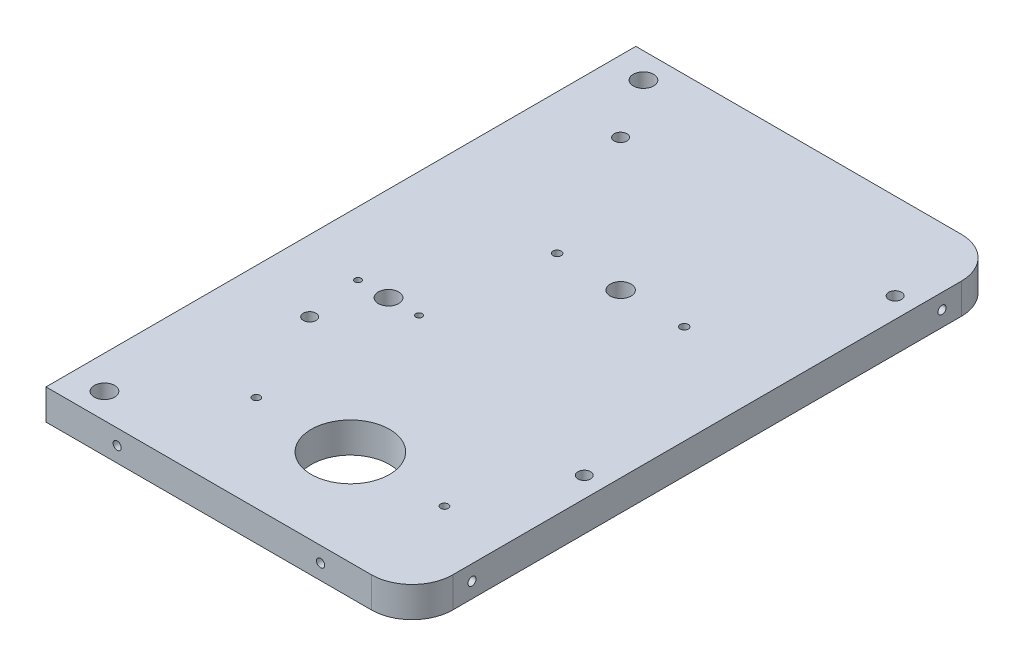
from build123d import *
from build123d.topology import SkipClean

# Parameters (mm, degrees)
SKETCH_1_W           = 20
SKETCH_1_H           = 44
EXTRUDE_1_DEPTH      = 3
SKETCH_2_R           = 0.8
CUT_EXTRUDE_1_DEPTH  = 3
SKETCH_3_W           = 21
SKETCH_3_H           = 44
EXTRUDE_3_DEPTH      = 3
SKETCH_4_W           = 62
SKETCH_4_H           = 25
EXTRUDE_4_DEPTH      = 3
SKETCH_5_R           = 2
SKETCH_5_W           = 62.003092034
SKETCH_5_H           = 2.997788852
CUT_EXTRUDE_2_DEPTH  = 3
SKETCH_6_W           = 62
SKETCH_6_H           = 20
EXTRUDE_5_DEPTH      = 3
SKETCH_7_R           = 0.8
SKETCH_7_R_2         = 0.25
CUT_EXTRUDE_4_DEPTH  = 3
SKETCH_8_R           = 0.8
EXTRUDE_6_DEPTH      = 3
CUT_EXTRUDE_5_DEPTH  = 3
SKETCH_15_R          = 1.5
CUT_EXTRUDE_6_DEPTH  = 3
SKETCH_24_W          = 62
SKETCH_24_H          = 13
EXTRUDE_7_DEPTH      = 3
SKETCH_25_W          = 62
SKETCH_25_H          = 15
SKETCH_25_R          = 1.5
EXTRUDE_8_DEPTH      = 3
SKETCH_26_R          = 1.5
CUT_EXTRUDE_7_DEPTH  = 3
SKETCH_31_R          = 1.5
EXTRUDE_10_DEPTH     = 3
SKETCH_36_R          = 7.7
CUT_EXTRUDE_12_DEPTH = 3
SKETCH_45_R          = 1.05
CUT_EXTRUDE_13_DEPTH = 3
SKETCH_50_R          = 1.999999997
CUT_EXTRUDE_14_DEPTH = 3
EXTRUDE_START        = -3
SKETCH_51_R          = 1.999999997
EXTRUDE_11_DEPTH     = 3
SKETCH_52_W          = 62
SKETCH_52_H          = 5
EXTRUDE_12_DEPTH     = 3
SKETCH_53_W          = 10
SKETCH_53_H          = 116
EXTRUDE_13_DEPTH     = 3
SKETCH_54_R          = 2
CUT_EXTRUDE_15_DEPTH = 10
CUT_EXTRUDE_17_DEPTH = 7
SKETCH_57_R          = 7.7
SKETCH_57_R_2        = 1.5
SKETCH_57_R_3        = 2
SKETCH_57_R_4        = 1.500025758
SKETCH_57_R_5        = 1.05
SKETCH_57_R_6        = 0.8
SKETCH_57_R_7        = 0.25
SKETCH_57_R_8        = 0.225
EXTRUDE_14_DEPTH     = 3
SKETCH_58_R          = 1
CUT_EXTRUDE_18_DEPTH = 6
SKETCH_59_R          = 1
CUT_EXTRUDE_19_DEPTH = 6
CUT_EXTRUDE_START    = -6
SKETCH_60_R          = 1
CUT_EXTRUDE_20_DEPTH = 6
SKETCH_61_R          = 3
CUT_EXTRUDE_21_DEPTH = 3
SKETCH_62_R          = 2
CUT_EXTRUDE_22_DEPTH = 3
SKETCH_63_R          = 2.55
CUT_EXTRUDE_23_DEPTH = 3
SKETCH_64_R          = 2.05
CUT_EXTRUDE_24_DEPTH = 3
SKETCH_65_R          = 2
EXTRUDE_15_DEPTH     = 6
SKETCH_66_R          = 1
CUT_EXTRUDE_25_DEPTH = 6
SKETCH_67_R          = 2.932086284
SKETCH_67_R_2        = 2.55
EXTRUDE_16_DEPTH     = 3
EXTRUDE_START_2      = -6
SKETCH_68_R          = 1.5
SKETCH_68_R_2        = 1.25
SKETCH_68_R_3        = 1
SKETCH_68_R_4        = 0.75
SKETCH_68_R_5        = 1.05
SKETCH_68_R_6        = 1.6
EXTRUDE_17_DEPTH     = 6
SKETCH_69_R          = 0.8
SKETCH_69_R_2        = 0.625
SKETCH_69_R_3        = 1
EXTRUDE_18_DEPTH     = 6
SKETCH_70_R          = 1
SKETCH_70_R_2        = 0.8
EXTRUDE_19_DEPTH     = 6
SKETCH_71_R          = 1
SKETCH_71_R_2        = 0.8
EXTRUDE_20_DEPTH     = 6
SKETCH_72_R          = 1
SKETCH_72_R_2        = 0.8
EXTRUDE_21_DEPTH     = 6
SKETCH_73_R          = 0.947367803
SKETCH_73_R_2        = 0.960169645
EXTRUDE_22_DEPTH     = 6
SKETCH_74_R          = 0.8
CUT_EXTRUDE_26_DEPTH = 6


with BuildPart() as part:
    # Эскиз1 → Бобышка-Вытянуть1 (new body)
    with BuildSketch(Plane(origin=(0, 0, 0), x_dir=(1, 0, 0), z_dir=(0, 1, 0))):
        Rectangle(SKETCH_1_W, SKETCH_1_H)
    extrude(amount=EXTRUDE_1_DEPTH)

    # Эскиз2 → Вырез-Вытянуть1 (cut)
    with BuildSketch(Plane(origin=(0, 3, 0), x_dir=(1, 0, 0), z_dir=(0, 1, 0))):
        with Locations(Location((6, -15, 0), (0, 0, 270))):
            Circle(SKETCH_2_R)
        with Locations(Location((-6, -15, 0), (0, 0, 270))):
            Circle(SKETCH_2_R)
    extrude(amount=-CUT_EXTRUDE_1_DEPTH, mode=Mode.SUBTRACT)

    # Эскиз3 → Бобышка-Вытянуть3 (add)
    with BuildSketch(Plane.XZ):
        with Locations((20.5, 0)):
            Rectangle(SKETCH_3_W, SKETCH_3_H)
        with Locations((-20.5, 0)):
            Rectangle(SKETCH_3_W, SKETCH_3_H)
    extrude(amount=-EXTRUDE_3_DEPTH)

    # Эскиз4 → Бобышка-Вытянуть4 (add)
    with BuildSketch(Plane(origin=(0, 0, 0), x_dir=(-1, 0, 0), z_dir=(0, -1, 0))):
        with Locations((0, 34.5)):
            Rectangle(SKETCH_4_W, SKETCH_4_H)
    extrude(amount=-EXTRUDE_4_DEPTH)

    # Эскиз5 → Вырез-Вытянуть2 (cut)
    with BuildSketch(Plane.XZ):
        with Locations(Location((22.498453983, -18, 0), (0, 0, 270))):
            Circle(SKETCH_5_R)
        with Locations(Location((-22.501546017, -18, 0), (0, 0, 90))):
            Circle(SKETCH_5_R)
        with Locations((-0.001546017, -45.501105574)):
            Rectangle(SKETCH_5_W, SKETCH_5_H)
    extrude(amount=-CUT_EXTRUDE_2_DEPTH, mode=Mode.SUBTRACT)

    # Эскиз6 → Бобышка-Вытянуть5 (add)
    with BuildSketch(Plane.XZ):
        with Locations((0, -54.002211148)):
            Rectangle(SKETCH_6_W, SKETCH_6_H)
        with Locations((0, 32)):
            Rectangle(SKETCH_6_W, SKETCH_6_H)
    extrude(amount=-EXTRUDE_5_DEPTH)

    # Эскиз7 → Вырез-Вытянуть4 (cut)
    with BuildSketch(Plane(origin=(0, 3, 0), x_dir=(1, 0, 0), z_dir=(0, 1, 0))):
        with Locations(Location((-16.501546017, -6.139753031, 0), (0, 0, 270))):
            Circle(SKETCH_7_R)
        with Locations(Location((-28.501546017, -6.139753031, 0), (0, 0, 270))):
            Circle(SKETCH_7_R)
        with Locations(Location((-21.23197804, -6.139414793, 0), (0, 0, 270))):
            Circle(SKETCH_7_R_2)
        with Locations(Location((-23.13293586, -5.037238659, 0), (0, 0, 270))):
            Circle(SKETCH_7_R_2)
        with Locations(Location((-23.13293586, -7.241590927, 0), (0, 0, 270))):
            Circle(SKETCH_7_R_2)
    extrude(amount=-CUT_EXTRUDE_4_DEPTH, mode=Mode.SUBTRACT)

    # Эскиз8 → Бобышка-Вытянуть6 (add)
    with BuildSketch(Plane(origin=(0, 3, 0), x_dir=(1, 0, 0), z_dir=(0, 1, 0))):
        with Locations((6, -15)):
            Circle(SKETCH_8_R)
        with Locations((-6, -15)):
            Circle(SKETCH_8_R)
    extrude(amount=-EXTRUDE_6_DEPTH)

    # Эскиз14 → Вырез-Вытянуть5 (cut)
    with BuildSketch(Plane(origin=(0, 3, 0), x_dir=(1, 0, 0), z_dir=(0, 1, 0))):
        Polygon((-0.001546017, -35), (-31, -35), (-31, -42), (-0.001546017, -42), (31, -42), (31, -35), align=None)
    extrude(amount=-CUT_EXTRUDE_5_DEPTH, mode=Mode.SUBTRACT)

    # Эскиз15 → Вырез-Вытянуть6 (cut)
    with BuildSketch(Plane(origin=(0, 3, 0), x_dir=(1, 0, 0), z_dir=(0, 1, 0))):
        with Locations(Location((-27, -31, 0), (0, 0, 270))):
            Circle(SKETCH_15_R)
        with Locations(Location((27, -31, 0), (0, 0, 90))):
            Circle(SKETCH_15_R)
        with Locations(Location((27, 44, 0), (0, 0, 270))):
            Circle(SKETCH_15_R)
        with Locations(Location((-27, 44, 0), (0, 0, 90))):
            Circle(SKETCH_15_R)
        Polygon((-0.001546017, 48), (31, 48), (31, 64.002211148), (-0.001546017, 64.002211148), (-31, 64.002211148), (-31, 48), align=None)
    extrude(amount=-CUT_EXTRUDE_6_DEPTH, mode=Mode.SUBTRACT)

    # Эскиз24 → Бобышка-Вытянуть7 (add)
    with BuildSketch(Plane.XZ):
        with Locations((0, -54.5)):
            Rectangle(SKETCH_24_W, SKETCH_24_H)
    extrude(amount=-EXTRUDE_7_DEPTH)

    # Эскиз25 → Бобышка-Вытянуть8 (add)
    with BuildSketch(Plane(origin=(0, 3, 0), x_dir=(1, 0, 0), z_dir=(0, 1, 0))):
        with Locations((0, -42.5)):
            Rectangle(SKETCH_25_W, SKETCH_25_H)
        with Locations(Location((27, -46, 0), (0, 0, 270))):
            Circle(SKETCH_25_R, mode=Mode.SUBTRACT)
        with Locations(Location((-27, -46, 0), (0, 0, 90))):
            Circle(SKETCH_25_R, mode=Mode.SUBTRACT)
    extrude(amount=-EXTRUDE_8_DEPTH)

    # Эскиз26 → Вырез-Вытянуть7 (cut)
    with BuildSketch(Plane(origin=(0, 3, 0), x_dir=(1, 0, 0), z_dir=(0, 1, 0))):
        with Locations(Location((-27, -17.139753031, 0), (0, 0, 270))):
            Circle(SKETCH_26_R)
        with Locations(Location((27, -17.139753031, 0), (0, 0, 270))):
            Circle(SKETCH_26_R)
    extrude(amount=-CUT_EXTRUDE_7_DEPTH, mode=Mode.SUBTRACT)

    # Эскиз31 → Бобышка-Вытянуть10 (add)
    with BuildSketch(Plane(origin=(0, 3, 0), x_dir=(1, 0, 0), z_dir=(0, 1, 0))):
        with Locations((-27, -31)):
            Circle(SKETCH_31_R)
        with Locations((27, -31)):
            Circle(SKETCH_31_R)
        with Locations((27, -46)):
            Circle(SKETCH_31_R)
        with Locations((-27, -46)):
            Circle(SKETCH_31_R)
    extrude(amount=-EXTRUDE_10_DEPTH)

    # Эскиз36 → Вырез-Вытянуть12 (cut)
    with BuildSketch(Plane.XZ):
        with Locations(Location((0, 36.139753031, 0), (0, 0, 270))):
            Circle(SKETCH_36_R)
    extrude(amount=-CUT_EXTRUDE_12_DEPTH, mode=Mode.SUBTRACT)

    # Эскиз45 → Вырез-Вытянуть13 (cut)
    with BuildSketch(Plane(origin=(0, 3, 0), x_dir=(1, 0, 0), z_dir=(0, 1, 0))):
        with Locations(Location((18.5, -36.139777203, 0), (0, 0, 270))):
            Circle(SKETCH_45_R)
        with Locations(Location((-18.5, -36.139777203, 0), (0, 0, 90))):
            Circle(SKETCH_45_R)
    extrude(amount=-CUT_EXTRUDE_13_DEPTH, mode=Mode.SUBTRACT)

    # Эскиз50 → Вырез-Вытянуть14 (cut)
    with BuildSketch(Plane(origin=(0, 3, 0), x_dir=(1, 0, 0), z_dir=(0, 1, 0))):
        with Locations(Location((26, 54.5, 0), (0, 0, 270))):
            Circle(SKETCH_50_R)
        with Locations(Location((-26.000000007, 54.5, 0), (0, 0, 90))):
            Circle(SKETCH_50_R)
    extrude(amount=-CUT_EXTRUDE_14_DEPTH, mode=Mode.SUBTRACT)

    # Эскиз51 → Бобышка-Вытянуть11 (add)
    with BuildSketch(Plane(origin=(0, 0, 0), x_dir=(-1, 0, 0), z_dir=(0, -1, 0)).offset(EXTRUDE_START)):
        with Locations((26.000000007, 54.5)):
            Circle(SKETCH_51_R)
        with Locations((-26, 54.5)):
            Circle(SKETCH_51_R)
    extrude(amount=EXTRUDE_11_DEPTH)

    # Эскиз52 → Бобышка-Вытянуть12 (add)
    with BuildSketch(Plane.XZ):
        with Locations((0, 52.5)):
            Rectangle(SKETCH_52_W, SKETCH_52_H)
    extrude(amount=-EXTRUDE_12_DEPTH)

    # Эскиз53 → Бобышка-Вытянуть13 (add)
    with BuildSketch(Plane.XZ):
        with Locations((-36, -3)):
            Rectangle(SKETCH_53_W, SKETCH_53_H)
    extrude(amount=-EXTRUDE_13_DEPTH)

    # Эскиз54 → Вырез-Вытянуть15 (cut)
    with BuildSketch(Plane.XZ):
        with Locations(Location((-34.5, 50, 0), (0, 0, 270))):
            Circle(SKETCH_54_R)
        with Locations(Location((-34.5, -56, 0), (0, 0, 90))):
            Circle(SKETCH_54_R)
    extrude(amount=-CUT_EXTRUDE_15_DEPTH, mode=Mode.SUBTRACT)

    # Эскиз55 → Вырез-Вытянуть17 (cut)
    with BuildSketch(Plane(origin=(0, 0, 0), x_dir=(-1, 0, 0), z_dir=(0, -1, 0))):
        with BuildLine():
            Line((-31, 61), (-23, 61))
            ThreePointArc((-23, 61), (-28.656854249, 58.656854249), (-31, 53))
            Line((-31, 53), (-31, 61))
        make_face()
        with BuildLine():
            Line((-31, -55), (-23, -55))
            ThreePointArc((-23, -55), (-28.656854249, -52.656854249), (-31, -47))
            Line((-31, -47), (-31, -55))
        make_face()
    extrude(amount=-CUT_EXTRUDE_17_DEPTH, mode=Mode.SUBTRACT)

    # Эскиз57 → Бобышка-Вытянуть14 (add)
    with BuildSketch(Plane.XZ):
        with BuildLine():
            Line((-41, 55), (23, 55))
            ThreePointArc((23, 55), (28.656854249, 52.656854249), (31, 47))
            Line((31, 47), (31, -53))
            ThreePointArc((31, -53), (28.656854249, -58.656854249), (23, -61))
            Line((23, -61), (-41, -61))
            Line((-41, -61), (-41, 55))
        make_face()
        with Locations(Location((0, 36.139753031, 0), (0, 0, 270))):
            Circle(SKETCH_57_R, mode=Mode.SUBTRACT)
        with Locations(Location((27, 17.139753031, 0), (0, 0, 90))):
            Circle(SKETCH_57_R_2, mode=Mode.SUBTRACT)
        with Locations(Location((-27, 17.139753031, 0), (0, 0, 90))):
            Circle(SKETCH_57_R_2, mode=Mode.SUBTRACT)
        with Locations(Location((-22.501546017, -18, 0), (0, 0, 270))):
            Circle(SKETCH_57_R_3, mode=Mode.SUBTRACT)
        with Locations(Location((22.498453983, -18, 0), (0, 0, 270))):
            Circle(SKETCH_57_R_3, mode=Mode.SUBTRACT)
        with Locations(Location((-27, -44, 0), (0, 0, 270))):
            Circle(SKETCH_57_R_4, mode=Mode.SUBTRACT)
        with Locations(Location((27, -44, 0), (0, 0, 90))):
            Circle(SKETCH_57_R_2, mode=Mode.SUBTRACT)
        with Locations(Location((-34.5, -56, 0), (0, 0, 270))):
            Circle(SKETCH_57_R_3, mode=Mode.SUBTRACT)
        with Locations(Location((-34.5, 50, 0), (0, 0, 270))):
            Circle(SKETCH_57_R_3, mode=Mode.SUBTRACT)
        with Locations(Location((-18.5, 36.139777203, 0), (0, 0, 270))):
            Circle(SKETCH_57_R_5, mode=Mode.SUBTRACT)
        with Locations(Location((18.5, 36.139777203, 0), (0, 0, 90))):
            Circle(SKETCH_57_R_5, mode=Mode.SUBTRACT)
        with Locations(Location((-16.501546017, 6.139753031, 0), (0, 0, 90))):
            Circle(SKETCH_57_R_6, mode=Mode.SUBTRACT)
        with Locations(Location((-28.501546017, 6.139753031, 0), (0, 0, 90))):
            Circle(SKETCH_57_R_6, mode=Mode.SUBTRACT)
        with Locations(Location((-23.132935794, 7.241590631, 0), (0, 0, 90.000015136))):
            Circle(SKETCH_57_R_7, mode=Mode.SUBTRACT)
        with Locations(Location((-21.231977973, 6.1394145, 0), (0, 0, 90.000015523))):
            Circle(SKETCH_57_R_7, mode=Mode.SUBTRACT)
        with Locations(Location((-23.13293579, 5.037238363, 0), (0, 0, 90.000015909))):
            Circle(SKETCH_57_R_7, mode=Mode.SUBTRACT)
        with Locations(Location((-3.521223918, -18.000032755, 0), (0, 0, 270))):
            Circle(SKETCH_57_R_8, mode=Mode.SUBTRACT)
        with Locations(Location((1.558776082, -18.000032755, 0), (0, 0, 270))):
            Circle(SKETCH_57_R_8, mode=Mode.SUBTRACT)
    extrude(amount=EXTRUDE_14_DEPTH)

    # Эскиз58 → Вырез-Вытянуть18 (cut)
    with BuildSketch(Plane(origin=(31, 0, 0), x_dir=(0, 0, -1), z_dir=(1, 0, 0))):
        with Locations((49.220009086, 0)):
            Circle(SKETCH_58_R)
        with Locations((-43.220009523, 0)):
            Circle(SKETCH_58_R)
    extrude(amount=-CUT_EXTRUDE_18_DEPTH, mode=Mode.SUBTRACT)

    # Эскиз59 → Вырез-Вытянуть19 (cut)
    with BuildSketch(Plane.XY.offset(55)):
        with Locations((13, 0)):
            Circle(SKETCH_59_R)
        with Locations((-27, 0)):
            Circle(SKETCH_59_R)
    extrude(amount=-CUT_EXTRUDE_19_DEPTH, mode=Mode.SUBTRACT)

    # Эскиз60 → Вырез-Вытянуть20 (cut)
    with BuildSketch(Plane(origin=(0, 0, -61), x_dir=(-1, 0, 0), z_dir=(0, 0, -1)).offset(CUT_EXTRUDE_START)):
        with Locations(Location((27, 0, 0), (0, 0, 180))):
            Circle(SKETCH_60_R)
        with Locations(Location((-13, 0, 0), (0, 0, 180))):
            Circle(SKETCH_60_R)
    extrude(amount=CUT_EXTRUDE_20_DEPTH, mode=Mode.SUBTRACT)

    # Эскиз61 → Вырез-Вытянуть21 (cut)
    with BuildSketch(Plane.XZ.offset(3)):
        with Locations(Location((-22.501977973, 6.139414498, 0), (0, 0, 270))):
            Circle(SKETCH_61_R)
    extrude(amount=-CUT_EXTRUDE_21_DEPTH, mode=Mode.SUBTRACT)

    # Эскиз62 → Вырез-Вытянуть22 (cut)
    with BuildSketch(Plane.XZ):
        with Locations(Location((-22.501977973, 6.139414498, 0), (0, 0, 270))):
            Circle(SKETCH_62_R)
    extrude(amount=-CUT_EXTRUDE_22_DEPTH, mode=Mode.SUBTRACT)

    # Эскиз63 → Вырез-Вытянуть23 (cut)
    with BuildSketch(Plane.XZ.offset(3)):
        with Locations((-0.981223814, -18.000033018)):
            Circle(SKETCH_63_R)
    extrude(amount=-CUT_EXTRUDE_23_DEPTH, mode=Mode.SUBTRACT)

    # Эскиз64 → Вырез-Вытянуть24 (cut)
    with BuildSketch(Plane.XZ):
        with Locations(Location((-0.981223814, -18.000033018, 0), (0, 0, 270))):
            Circle(SKETCH_64_R)
    extrude(amount=-CUT_EXTRUDE_24_DEPTH, mode=Mode.SUBTRACT)

    # Эскиз65 → Бобышка-Вытянуть15 (add)
    with BuildSketch(Plane(origin=(0, -3, 0), x_dir=(-1, 0, 0), z_dir=(0, -1, 0))):
        with Locations((22.501546017, 18)):
            Circle(SKETCH_65_R)
        with Locations((-22.498453983, 18)):
            Circle(SKETCH_65_R)
    extrude(amount=-EXTRUDE_15_DEPTH)

    # Эскиз66 → Вырез-Вытянуть25 (cut)
    with BuildSketch(Plane.XZ.offset(3)):
        with Locations(Location((10.604776186, -18.000033018, 0), (0, 0, 270))):
            Circle(SKETCH_66_R)
        with Locations(Location((-12.567223814, -18.000033018, 0), (0, 0, 90))):
            Circle(SKETCH_66_R)
    extrude(amount=-CUT_EXTRUDE_25_DEPTH, mode=Mode.SUBTRACT)

    # Эскиз67 → Бобышка-Вытянуть16 (add)
    with BuildSketch(Plane.XZ.offset(3)):
        with Locations((-0.981223814, -18.000033018)):
            Circle(SKETCH_67_R)
        with Locations(Location((-0.981223814, -18.000033018, 0), (0, 0, 270))):
            Circle(SKETCH_67_R_2, mode=Mode.SUBTRACT)
    extrude(amount=-EXTRUDE_16_DEPTH)

    # Эскиз68 → Бобышка-Вытянуть17 (add)
    # profile 1 of 8: a face of its own
    with SkipClean():  # the faces are left unmerged after this step: merging them gives an invalid solid
        with BuildSketch(Plane.XZ.offset(3).offset(EXTRUDE_START_2)):
            with Locations((27, 17.139753031)):
                Circle(SKETCH_68_R)
            with Locations(Location((27, 17.139753031, 0), (0, 0, 270))):
                Circle(SKETCH_68_R_2, mode=Mode.SUBTRACT)
        # profile 2 of 8: a face of its own
        with BuildSketch(Plane.XZ.offset(3).offset(EXTRUDE_START_2)):
            with Locations((27, -44)):
                Circle(SKETCH_68_R)
            with Locations(Location((27, -44, 0), (0, 0, 270))):
                Circle(SKETCH_68_R_2, mode=Mode.SUBTRACT)
        # profile 3 of 8: a face of its own
        with BuildSketch(Plane.XZ.offset(3).offset(EXTRUDE_START_2)):
            with Locations((-27, 17.139753031)):
                Circle(SKETCH_68_R)
            with Locations(Location((-27, 17.139753031, 0), (0, 0, 270))):
                Circle(SKETCH_68_R_2, mode=Mode.SUBTRACT)
        # profile 4 of 8: a face of its own
        with BuildSketch(Plane.XZ.offset(3).offset(EXTRUDE_START_2)):
            with Locations((10.604776186, -18.000033018)):
                Circle(SKETCH_68_R_3)
            with Locations(Location((10.604776186, -18.000033018, 0), (0, 0, 270))):
                Circle(SKETCH_68_R_4, mode=Mode.SUBTRACT)
        # profile 5 of 8: a face of its own
        with BuildSketch(Plane.XZ.offset(3).offset(EXTRUDE_START_2)):
            with Locations((-12.567223814, -18.000033018)):
                Circle(SKETCH_68_R_3)
            with Locations(Location((-12.567223814, -18.000033018, 0), (0, 0, 90))):
                Circle(SKETCH_68_R_4, mode=Mode.SUBTRACT)
        # profile 6 of 8: a face of its own
        with BuildSketch(Plane.XZ.offset(3).offset(EXTRUDE_START_2)):
            with Locations((18.5, 36.139777203)):
                Circle(SKETCH_68_R_5)
            with Locations(Location((18.5, 36.139777203, 0), (0, 0, 270))):
                Circle(SKETCH_68_R_4, mode=Mode.SUBTRACT)
        # profile 7 of 8: a face of its own
        with BuildSketch(Plane.XZ.offset(3).offset(EXTRUDE_START_2)):
            with Locations((-18.5, 36.139777203)):
                Circle(SKETCH_68_R_5)
            with Locations(Location((-18.5, 36.139777203, 0), (0, 0, 90))):
                Circle(SKETCH_68_R_4, mode=Mode.SUBTRACT)
        # profile 8 of 8: a face of its own
        with BuildSketch(Plane.XZ.offset(3).offset(EXTRUDE_START_2)):
            with Locations((-27, -44)):
                Circle(SKETCH_68_R_6)
            with Locations(Location((-27, -44, 0), (0, 0, 90))):
                Circle(SKETCH_68_R_2, mode=Mode.SUBTRACT)
        extrude(amount=EXTRUDE_17_DEPTH)

    # Эскиз69 → Бобышка-Вытянуть18 (add)
    # profile 1 of 2: a face of its own
    with SkipClean():  # the faces are left unmerged after this step: merging them gives an invalid solid
        with BuildSketch(Plane.XZ.offset(3).offset(EXTRUDE_START_2)):
            with Locations((-16.501546017, 6.139753031)):
                Circle(SKETCH_69_R)
            with Locations(Location((-16.501546017, 6.139753031, 0), (0, 0, 270))):
                Circle(SKETCH_69_R_2, mode=Mode.SUBTRACT)
        # profile 2 of 2: a face of its own
        with BuildSketch(Plane.XZ.offset(3).offset(EXTRUDE_START_2)):
            with Locations((-28.502409928, 6.139753031)):
                Circle(SKETCH_69_R_3)
            with Locations(Location((-28.502409928, 6.139753031, 0), (0, 0, 90))):
                Circle(SKETCH_69_R_2, mode=Mode.SUBTRACT)
        extrude(amount=EXTRUDE_18_DEPTH)

    # Эскиз70 → Бобышка-Вытянуть19 (add)
    # profile 1 of 2: a face of its own
    with SkipClean():  # the faces are left unmerged after this step: merging them gives an invalid solid
        with BuildSketch(Plane(origin=(0, 0, -61), x_dir=(-1, 0, 0), z_dir=(0, 0, -1)).offset(EXTRUDE_START_2)):
            with Locations(Location((-13, 0, 0), (0, 0, 180))):
                Circle(SKETCH_70_R)
            with Locations((-13, 0)):
                Circle(SKETCH_70_R_2, mode=Mode.SUBTRACT)
        # profile 2 of 2: a face of its own
        with BuildSketch(Plane(origin=(0, 0, -61), x_dir=(-1, 0, 0), z_dir=(0, 0, -1)).offset(EXTRUDE_START_2)):
            with Locations(Location((27, 0, 0), (0, 0, 180))):
                Circle(SKETCH_70_R)
            with Locations((27, 0)):
                Circle(SKETCH_70_R_2, mode=Mode.SUBTRACT)
        extrude(amount=EXTRUDE_19_DEPTH)

    # Эскиз71 → Бобышка-Вытянуть20 (add)
    # profile 1 of 2: a face of its own
    with SkipClean():  # the faces are left unmerged after this step: merging them gives an invalid solid
        with BuildSketch(Plane(origin=(31, 0, 0), x_dir=(0, 0, -1), z_dir=(1, 0, 0))):
            with Locations((-43.220009523, 0)):
                Circle(SKETCH_71_R)
            with Locations((-43.220009523, 0)):
                Circle(SKETCH_71_R_2, mode=Mode.SUBTRACT)
        # profile 2 of 2: a face of its own
        with BuildSketch(Plane(origin=(31, 0, 0), x_dir=(0, 0, -1), z_dir=(1, 0, 0))):
            with Locations((49.220009086, 0)):
                Circle(SKETCH_71_R)
            with Locations((49.220009086, 0)):
                Circle(SKETCH_71_R_2, mode=Mode.SUBTRACT)
        extrude(amount=-EXTRUDE_20_DEPTH)

    # Эскиз72 → Бобышка-Вытянуть21 (add)
    # profile 1 of 2: a face of its own
    with SkipClean():  # the faces are left unmerged after this step: merging them gives an invalid solid
        with BuildSketch(Plane.XY.offset(55)):
            with Locations((-27, 0)):
                Circle(SKETCH_72_R)
            with Locations(Location((-27, 0, 0), (0, 0, 180))):
                Circle(SKETCH_72_R_2, mode=Mode.SUBTRACT)
        # profile 2 of 2: a face of its own
        with BuildSketch(Plane.XY.offset(55)):
            with Locations((13, 0)):
                Circle(SKETCH_72_R)
            with Locations(Location((13, 0, 0), (0, 0, 180))):
                Circle(SKETCH_72_R_2, mode=Mode.SUBTRACT)
        extrude(amount=-EXTRUDE_21_DEPTH)

    # Эскиз73 → Бобышка-Вытянуть22 (add)
    with SkipClean():  # the faces are left unmerged after this step: merging them gives an invalid solid
        with BuildSketch(Plane.XZ.offset(3)):
            with Locations((-12.567223814, -18.000033018)):
                Circle(SKETCH_73_R)
            with Locations((10.604776186, -18.000033018)):
                Circle(SKETCH_73_R_2)
        extrude(amount=-EXTRUDE_22_DEPTH)

    # Эскиз74 → Вырез-Вытянуть26 (cut)
    with SkipClean():  # the faces are left unmerged after this step: merging them gives an invalid solid
        with BuildSketch(Plane.XZ.offset(3)):
            with Locations(Location((-13.481223814, -18.000033018, 0), (0, 0, 270))):
                Circle(SKETCH_74_R)
            with Locations(Location((11.518776186, -18.000033018, 0), (0, 0, 270))):
                Circle(SKETCH_74_R)
        extrude(amount=-CUT_EXTRUDE_26_DEPTH, mode=Mode.SUBTRACT)


solid = part.part
